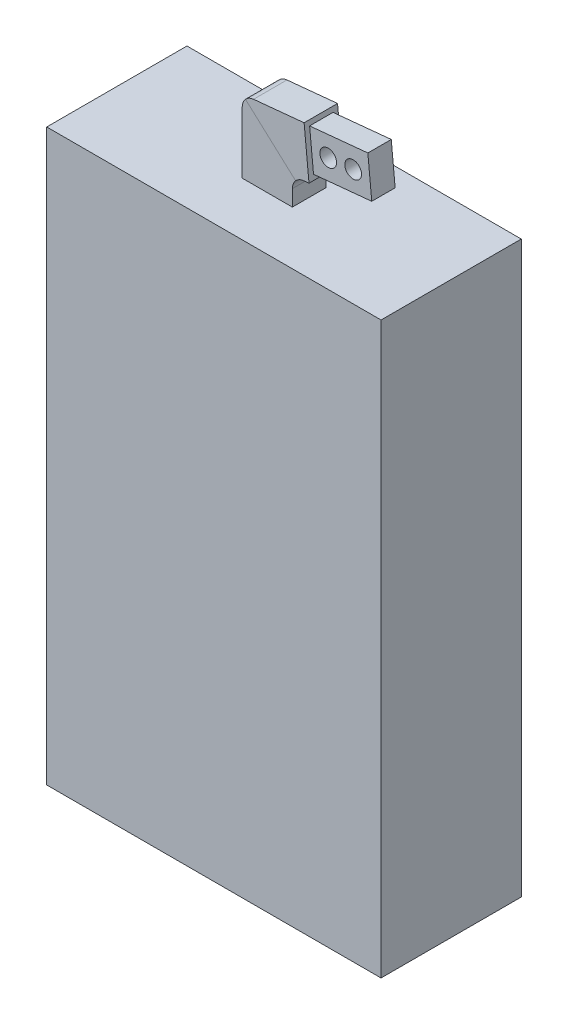
from build123d import *

# Parameters (mm, degrees)
SKETCH1_W                  = 200
SKETCH1_H                  = 83.89
WHEEL_STEERING_DUMMY_DEPTH = 340.92
SKETCH4_W                  = 30
SKETCH4_H                  = 20
SKETCH5_W                  = 20
SKETCH5_H                  = 30
SKETCH5_W_2                = 14
SKETCH5_H_2                = 24
MOUNT_TONGUE_DEPTH         = 35
SKETCH6_R                  = 5
MOUNT_HOLES_DEPTH          = 359.639177203
FILLET1_R                  = 7.5


with BuildPart() as part:
    # Sketch1 → Wheel & Steering Dummy (new body)
    with BuildSketch(Plane(origin=(0, 0, 0), x_dir=(1, 0, 0), z_dir=(0, 1, 0))):
        Rectangle(SKETCH1_W, SKETCH1_H)
    extrude(amount=-WHEEL_STEERING_DUMMY_DEPTH)

    # Mount Body: sweep along a path in Sketch3
    with BuildLine(Plane.XY) as mount_body_path:
        Line((0, 0), (0, 30))
        Line((0, 30), (58.328201005, 35.698665242))
    # Sketch4 → Mount Body (sweep)
    with BuildSketch(Plane(origin=(0, 0, 0), x_dir=(1, 0, 0), z_dir=(0, 1, 0))):
        Rectangle(SKETCH4_W, SKETCH4_H)
    sweep(path=mount_body_path.line, transition=Transition.RIGHT)

    # Sketch5 → Mount Tongue (cut)
    with BuildSketch(Plane(origin=(61.231488288, 5.982316409, 0), x_dir=(0, 0, -1), z_dir=(0.9952612526754551, 0.09723702444482771, 0))):
        with Locations((0, 29.85783758)):
            Rectangle(SKETCH5_W, SKETCH5_H)
        with Locations((0, 29.85783758)):
            Rectangle(SKETCH5_W_2, SKETCH5_H_2, mode=Mode.SUBTRACT)
    extrude(amount=-MOUNT_TONGUE_DEPTH, mode=Mode.SUBTRACT)

    # Sketch6 → Mount Holes (cut, through all)
    with BuildSketch(Plane.XY.offset(7)):
        with Locations((33.446669688, 33.26773963)):
            Circle(SKETCH6_R)
        with Locations((48.375588478, 34.726294997)):
            Circle(SKETCH6_R)
    extrude(amount=-MOUNT_HOLES_DEPTH, mode=Mode.SUBTRACT)

    # Fillet1
    fillet1_edges = [part.edges().sort_by_distance(p)[0] for p in [
        (-15, 43.605919649, 0),
        (15, 16.394080351, 0),
    ]]
    fillet(fillet1_edges, radius=FILLET1_R)


solid = part.part
